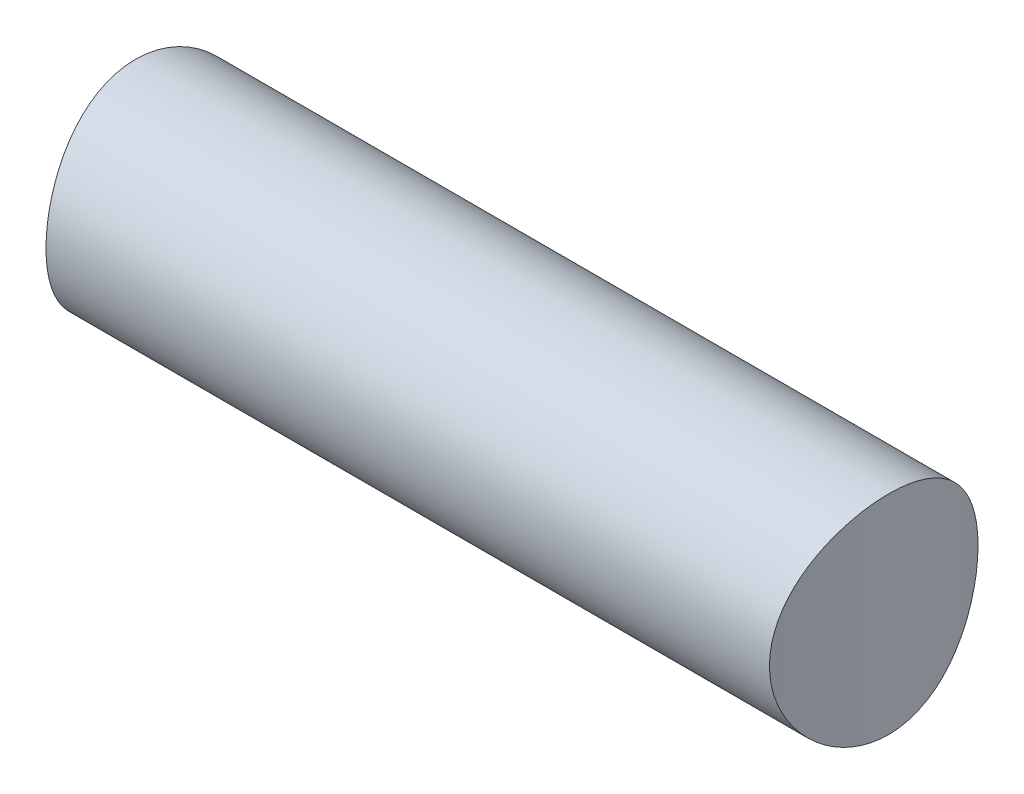
from build123d import *

# Parameters (mm, degrees)
CROQUIS3_R                 = 6.86
SALIENTE_EXTRUIR2_DEPTH    = 10
CORTAR_EXTRUIR2_DEPTH      = 14.932666651
CORTAR_EXTRUIR2_DEPTH_BACK = 14.932666651
CROQUIS4_OUTSIDE_W         = 20.086
CROQUIS4_OUTSIDE_H         = 16.366
CROQUIS4_OUTSIDE_R         = 1.9


with BuildPart() as part:
    # Croquis3 → Saliente-Extruir2 (new body)
    with BuildSketch(Plane(origin=(0, 0, 0), x_dir=(1, 0, 0), z_dir=(0, 1, 0))):
        with Locations(Location((0, 0, 0), (0, 0, 270))):
            Circle(CROQUIS3_R)
    extrude(amount=SALIENTE_EXTRUIR2_DEPTH)

    # Croquis4 outside → Cortar-Extruir2 (cut, two sides: drawn at the far end of the back side and taken through both)
    with BuildSketch(Plane(origin=(0, 0, 0), x_dir=(0, 0, -1), z_dir=(1, 0, 0)).offset(-CORTAR_EXTRUIR2_DEPTH_BACK)):
        with Locations((0, 5)):
            Rectangle(CROQUIS4_OUTSIDE_W, CROQUIS4_OUTSIDE_H)
        with Locations((0, 6)):
            Circle(CROQUIS4_OUTSIDE_R, mode=Mode.SUBTRACT)
    extrude(amount=CORTAR_EXTRUIR2_DEPTH + CORTAR_EXTRUIR2_DEPTH_BACK, mode=Mode.SUBTRACT)


solid = part.part
